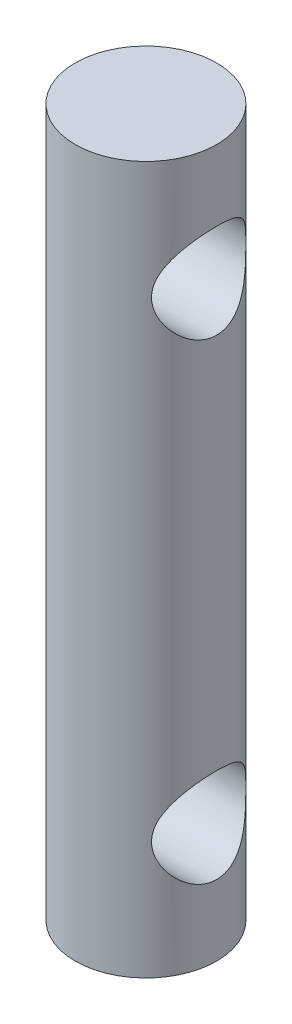
from build123d import *

# Parameters (mm, degrees)
SZKIC1_R                    = 3
DODANIE_WYCI_GNI_CIE1_DEPTH = 30
SZKIC2_R                    = 2
WYTNIJ_WYCI_GNI_CIE1_DEPTH  = 7.5


with BuildPart() as part:
    # Szkic1 → Dodanie-wyciągnięcie1 (new body)
    with BuildSketch(Plane(origin=(0, 0, 0), x_dir=(1, 0, 0), z_dir=(0, 1, 0))):
        with Locations(Location((0, 0, 0), (0, 0, 270))):
            Circle(SZKIC1_R)
    extrude(amount=DODANIE_WYCI_GNI_CIE1_DEPTH)

    # Szkic2 → Wytnij-wyciągnięcie1 (cut, symmetric)
    with BuildSketch(Plane(origin=(0, 0, 0), x_dir=(0, 0, -1), z_dir=(1, 0, 0))):
        with Locations((0, 25)):
            Circle(SZKIC2_R)
        with Locations((0, 5)):
            Circle(SZKIC2_R)
    extrude(amount=WYTNIJ_WYCI_GNI_CIE1_DEPTH, both=True, mode=Mode.SUBTRACT)


solid = part.part
